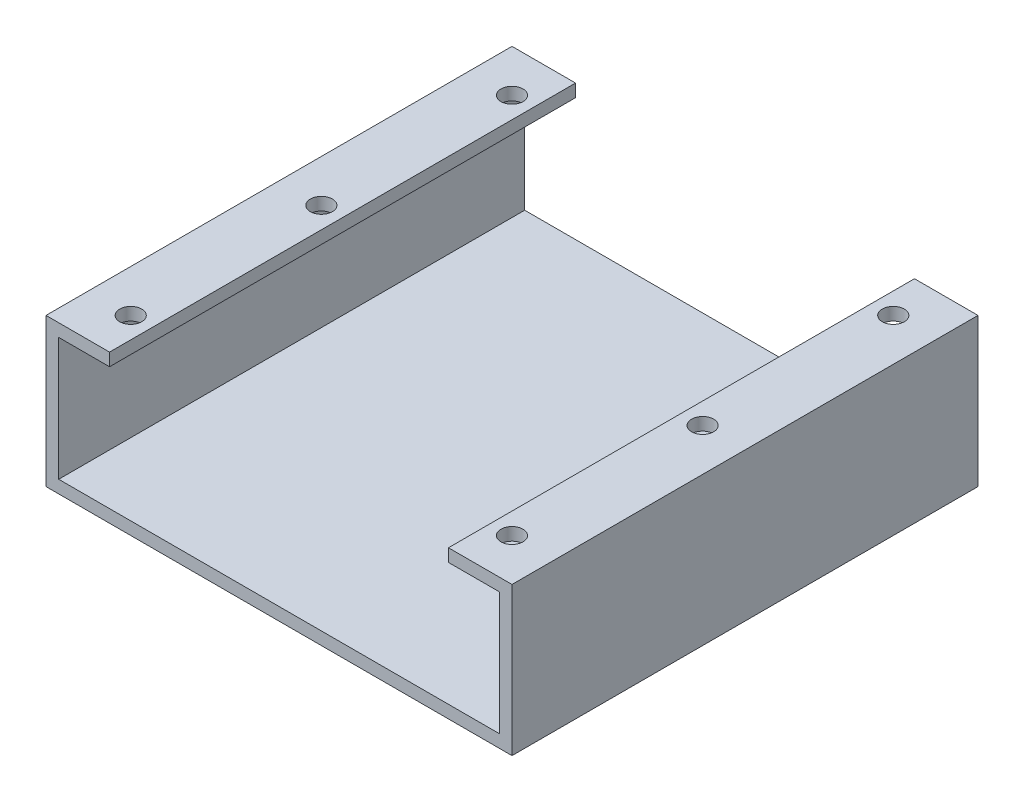
from build123d import *

# Parameters (mm, degrees)
EXTRUDE_1_DEPTH     = 110
SKETCH_2_R          = 2.6
CUT_EXTRUDE_1_DEPTH = 3


with BuildPart() as part:
    # 草图1 → 凸台-拉伸1 (new body)
    with BuildSketch(Plane.XY):
        Polygon((0, 0), (110, 0), (110, 35), (95, 35), (95, 32), (107, 32), (107, 3), (3, 3), (3, 32), (15, 32), (15, 35), (0, 35), align=None)
    extrude(amount=EXTRUDE_1_DEPTH)

    # 草图2 → 切除-拉伸1 (cut)
    with BuildSketch(Plane(origin=(0, 35, 0), x_dir=(1, 0, 0), z_dir=(0, 1, 0))):
        with Locations(Location((10, -10, 0), (0, 0, 270))):
            Circle(SKETCH_2_R)
        with Locations(Location((100, -10, 0), (0, 0, 270))):
            Circle(SKETCH_2_R)
        with Locations(Location((100, -55, 0), (0, 0, 270))):
            Circle(SKETCH_2_R)
        with Locations(Location((100, -100, 0), (0, 0, 270))):
            Circle(SKETCH_2_R)
        with Locations(Location((10, -55, 0), (0, 0, 270))):
            Circle(SKETCH_2_R)
        with Locations(Location((10, -100, 0), (0, 0, 270))):
            Circle(SKETCH_2_R)
    extrude(amount=-CUT_EXTRUDE_1_DEPTH, mode=Mode.SUBTRACT)


solid = part.part
